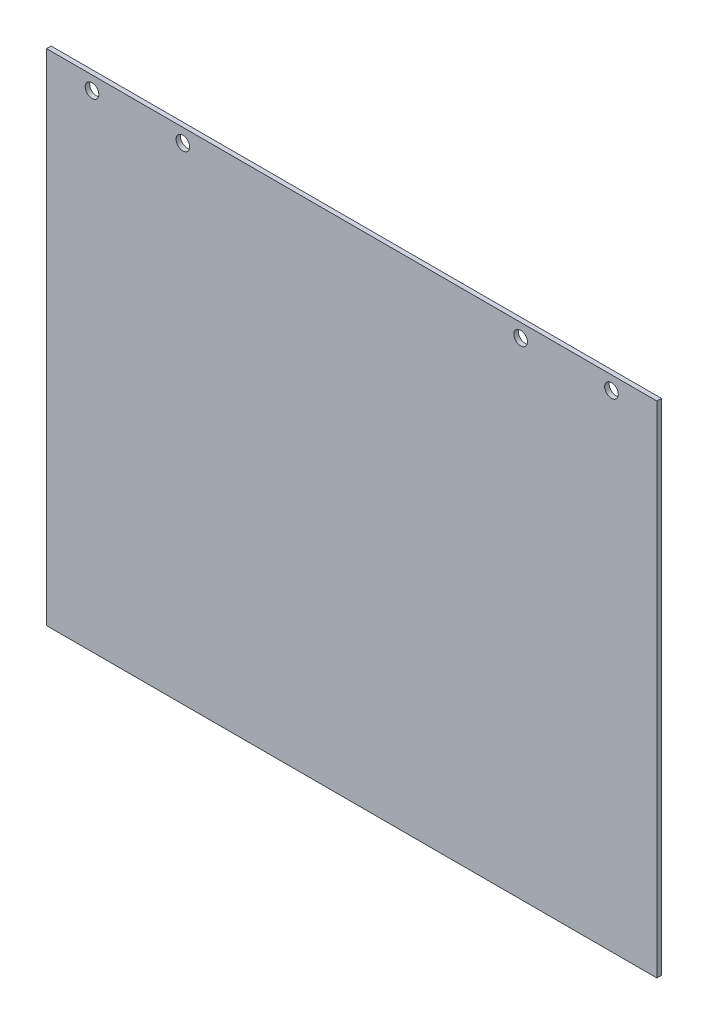
from build123d import *

# Parameters (mm, degrees)
SKETCH_1_W      = 134.350288425
SKETCH_1_H      = 110
SKETCH_1_R      = 1.5
EXTRUDE_1_DEPTH = 1


with BuildPart() as part:
    # 草图1 → 凸台-拉伸1 (new body)
    with BuildSketch(Plane.XY):
        with Locations((67.175144213, 55)):
            Rectangle(SKETCH_1_W, SKETCH_1_H)
        with Locations((10, 107)):
            Circle(SKETCH_1_R, mode=Mode.SUBTRACT)
        with Locations((30, 107)):
            Circle(SKETCH_1_R, mode=Mode.SUBTRACT)
        with Locations(Location((104.350288425, 107, 0), (0, 0, 180))):
            Circle(SKETCH_1_R, mode=Mode.SUBTRACT)
        with Locations(Location((124.350288425, 107, 0), (0, 0, 180))):
            Circle(SKETCH_1_R, mode=Mode.SUBTRACT)
    extrude(amount=EXTRUDE_1_DEPTH)


solid = part.part
